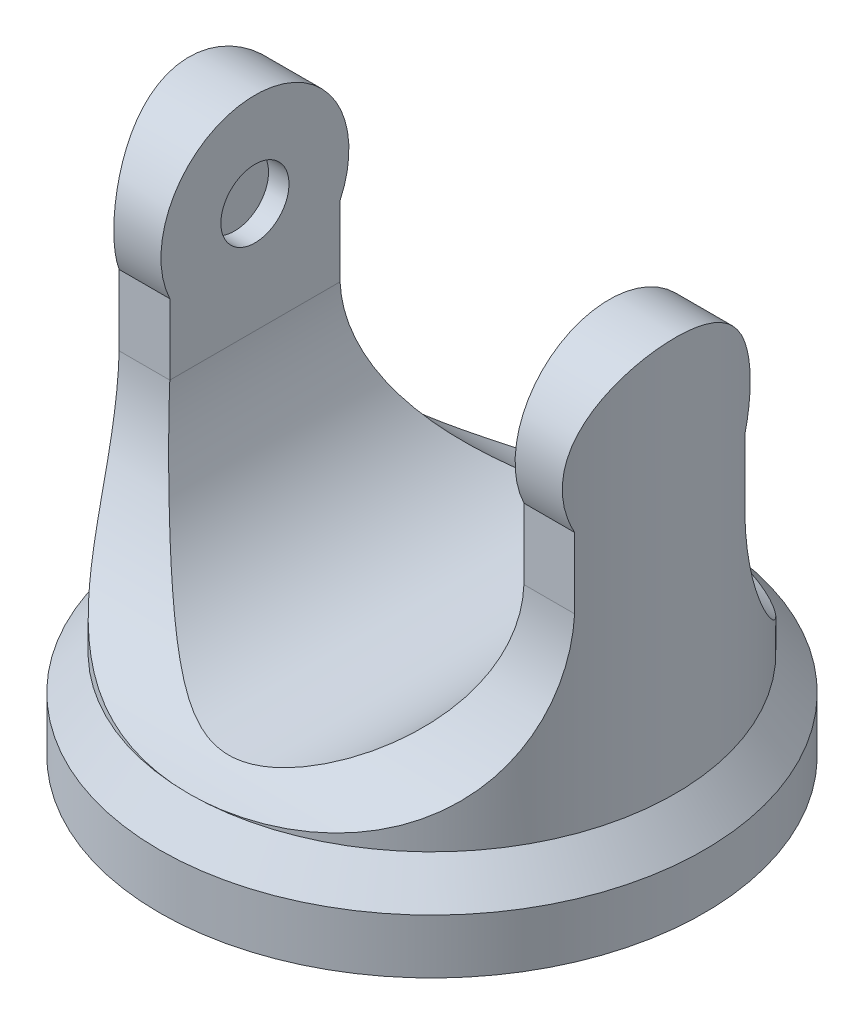
from build123d import *

# Parameters (mm, degrees)
SKETCH_1_R               = 40
EXTRUDE_1_DEPTH          = 13
SKETCH_3_R               = 35.7
EXTRUDE_2_DEPTH          = 58
CUT_EXTRUDE_1_DEPTH      = 58
CUT_EXTRUDE_1_DEPTH_BACK = 58
CUT_EXTRUDE_2_DEPTH      = 58
CUT_EXTRUDE_2_DEPTH_BACK = 58
SKETCH_6_R               = 5
CUT_EXTRUDE_3_DEPTH      = 3


with BuildPart() as part:
    # 草图1 → 凸台-拉伸1 (new body)
    with BuildSketch(Plane(origin=(0, 0, 0), x_dir=(1, 0, 0), z_dir=(0, 1, 0))):
        Circle(SKETCH_1_R)
    extrude(amount=EXTRUDE_1_DEPTH)

    # 草图2 → 切除-旋转1 (revolve, cut)
    with BuildSketch(Plane.XY):
        Polygon((-35.7, 13), (-40, 8), (-40, 13), align=None)
    revolve(axis=Axis((0, 13, 0), (0, -1, 0)), mode=Mode.SUBTRACT)

    # 草图3 → 凸台-拉伸2 (add)
    with BuildSketch(Plane(origin=(0, 13, 0), x_dir=(1, 0, 0), z_dir=(0, 1, 0))):
        Circle(SKETCH_3_R)
    extrude(amount=EXTRUDE_2_DEPTH)

    # 草图4 → 切除-拉伸1 (cut, two sides: drawn at the far end of the back side and taken through both)
    with BuildSketch(Plane(origin=(0, 0, 0), x_dir=(0, 0, -1), z_dir=(1, 0, 0)).offset(-CUT_EXTRUDE_1_DEPTH_BACK)):
        with BuildLine():
            ThreePointArc((-35.7, 13), (-19.374333005, 23.084447347), (-12.5, 41))
            Line((-12.5, 41), (-12.5, 51.352778438))
            ThreePointArc((-12.5, 51.352778438), (-11.643273972, 64.607710255), (0, 71))
            Line((0, 71), (-35.7, 71))
            Line((-35.7, 71), (-35.7, 13))
        make_face()
        with BuildLine():
            Line((35.7, 71), (0, 71))
            ThreePointArc((0, 71), (11.643273972, 64.607710255), (12.5, 51.352778438))
            Line((12.5, 51.352778438), (12.5, 41))
            ThreePointArc((12.5, 41), (19.374333005, 23.084447347), (35.7, 13))
            Line((35.7, 13), (35.7, 71))
        make_face()
    extrude(amount=CUT_EXTRUDE_1_DEPTH + CUT_EXTRUDE_1_DEPTH_BACK, mode=Mode.SUBTRACT)

    # 草图5 → 切除-拉伸2 (cut, two sides: drawn at the far end of the back side and taken through both)
    with BuildSketch(Plane.XY.offset(-CUT_EXTRUDE_2_DEPTH_BACK)):
        with BuildLine():
            Line((-26, 71), (-26, 41))
            ThreePointArc((-26, 41), (0, 15), (26, 41))
            Line((26, 41), (26, 71))
            Line((26, 71), (-26, 71))
        make_face()
    extrude(amount=CUT_EXTRUDE_2_DEPTH + CUT_EXTRUDE_2_DEPTH_BACK, mode=Mode.SUBTRACT)

    # 草图6 → 切除-拉伸3 (cut)
    with BuildSketch(Plane.ZY.offset(-26)):
        with Locations((0, 57.2)):
            Circle(SKETCH_6_R)
    cut_extrude_3 = extrude(amount=-CUT_EXTRUDE_3_DEPTH, mode=Mode.SUBTRACT)

    # 镜向1: 切除-拉伸3 across plane
    add(cut_extrude_3.mirror(Plane(origin=(0, 0, 0), x_dir=(0, 0, 1), z_dir=(1, 0, 0))), mode=Mode.SUBTRACT)


solid = part.part
